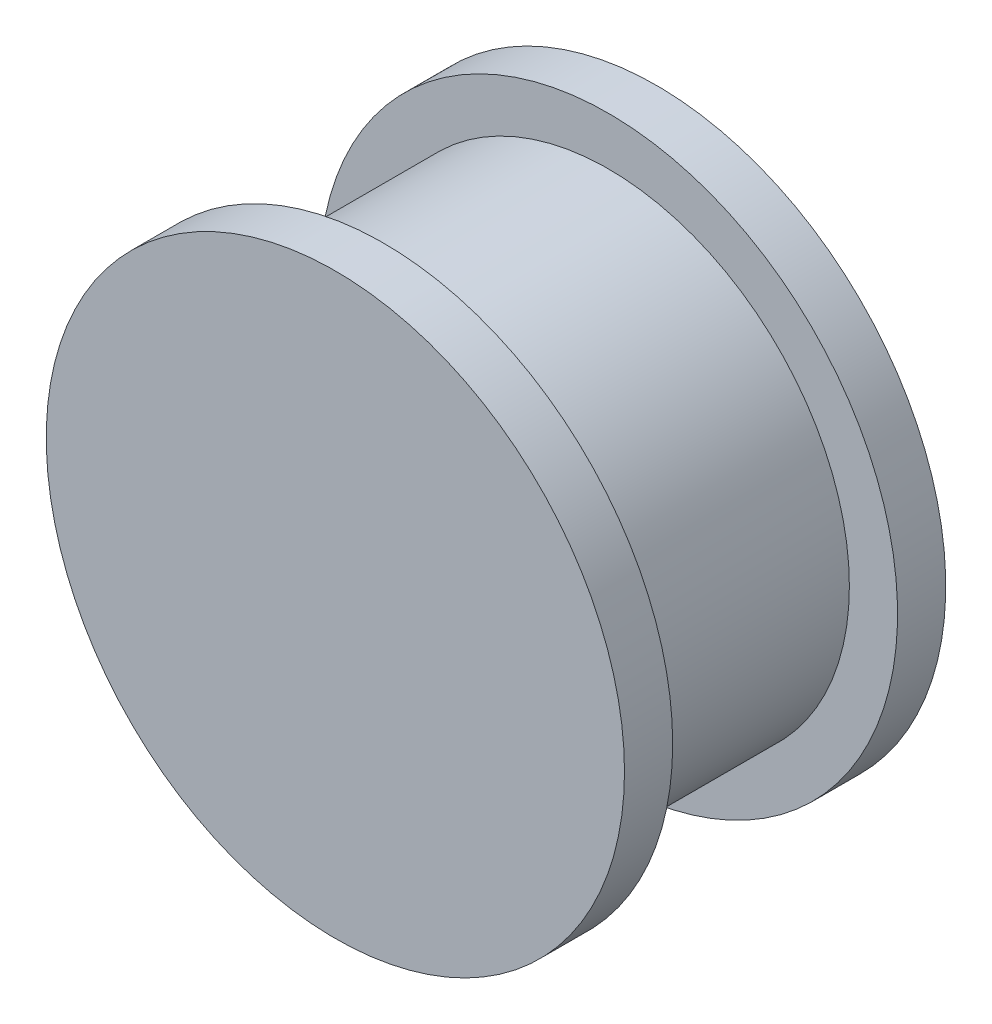
from build123d import *

# Parameters (mm, degrees)
SKETCH1_R           = 7.5
SKETCH1_R_2         = 6.5
BOSS_EXTRUDE2_DEPTH = 7
SKETCH3_R           = 9
BOSS_EXTRUDE3_DEPTH = 1.5
SKETCH4_R           = 9
SKETCH4_R_2         = 6.5
BOSS_EXTRUDE4_DEPTH = 1.5


with BuildPart() as part:
    # Sketch1 → Boss-Extrude2 (new body)
    with BuildSketch(Plane.XY):
        Circle(SKETCH1_R)
        Circle(SKETCH1_R_2, mode=Mode.SUBTRACT)
    extrude(amount=BOSS_EXTRUDE2_DEPTH)

    # Sketch3 → Boss-Extrude3 (add)
    with BuildSketch(Plane.XY.offset(7)):
        Circle(SKETCH3_R)
    extrude(amount=BOSS_EXTRUDE3_DEPTH)


with BuildPart() as body_2:
    # Sketch4 → Boss-Extrude4 (new body)
    with BuildSketch(Plane(origin=(0, 0, 0), x_dir=(-1, 0, 0), z_dir=(0, 0, -1))):
        Circle(SKETCH4_R)
        Circle(SKETCH4_R_2, mode=Mode.SUBTRACT)
    extrude(amount=BOSS_EXTRUDE4_DEPTH)


solid = Compound([part.part, body_2.part])
